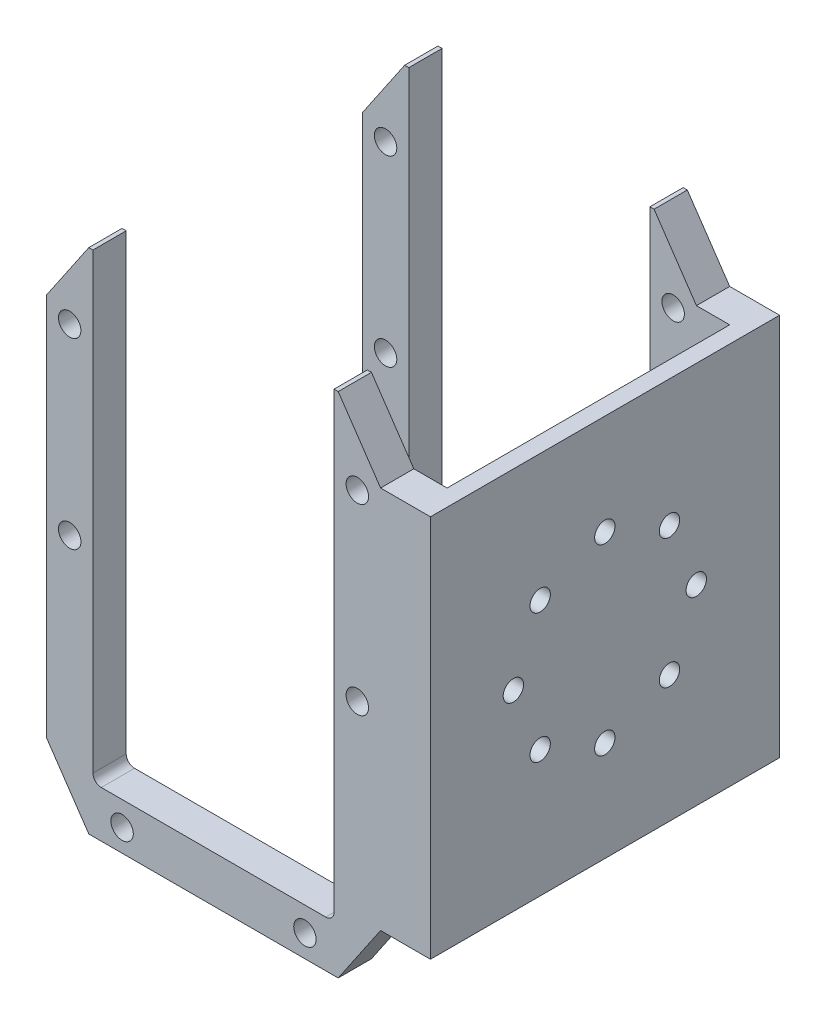
from build123d import *

# Parameters (mm, degrees)
EXTRUDE_2_DEPTH     = 42
SKETCH_2_R          = 1.35
CUT_EXTRUDE_1_DEPTH = 45
CUT_EXTRUDE_2_DEPTH = 45
SKETCH_4_W          = 4
SKETCH_4_H          = 46.1
EXTRUDE_3_DEPTH     = 4
SKETCH_5_W          = 2
SKETCH_5_H          = 46.1
EXTRUDE_4_DEPTH     = 42
SKETCH_6_R          = 1.225
CUT_EXTRUDE_3_DEPTH = 10


with BuildPart() as part:
    # 스케치1 → 보스-돌출2 (new body)
    with BuildSketch(Plane.XY):
        with BuildLine():
            Line((-14.5, -41.5), (-14.5, 11.5))
            Line((-14.5, 11.5), (-14.5, 13))
            Line((-14.5, 13), (-15, 13))
            Line((-15, 13), (-20.1, 5.5))
            Line((-20.1, 5.5), (-20.1, -40.6))
            Line((-20.1, -40.6), (-15, -48.1))
            Line((-15, -48.1), (15, -48.1))
            Line((15, -48.1), (20.1, -40.6))
            Line((20.1, -40.6), (20.1, 5.5))
            Line((20.1, 5.5), (15, 13))
            Line((15, 13), (14.5, 13))
            Line((14.5, 13), (14.5, 11.5))
            Line((14.5, 11.5), (14.5, -41.5))
            ThreePointArc((14.5, -41.5), (14.207106781, -42.207106781), (13.5, -42.5))
            Line((13.5, -42.5), (-13.5, -42.5))
            ThreePointArc((-13.5, -42.5), (-14.207106781, -42.207106781), (-14.5, -41.5))
        make_face()
    extrude(amount=EXTRUDE_2_DEPTH)

    # 스케치2 → 컷-돌출1 (cut)
    with BuildSketch(Plane(origin=(0, 0, 0), x_dir=(-1, 0, 0), z_dir=(0, 0, -1))):
        with Locations((-11, -45.405560676)):
            Circle(SKETCH_2_R)
        with Locations((11, -45.405560676)):
            Circle(SKETCH_2_R)
        with Locations((17.3, 3.87)):
            Circle(SKETCH_2_R)
        with Locations((17.3, -18.13)):
            Circle(SKETCH_2_R)
        with Locations((-17.3, 3.87)):
            Circle(SKETCH_2_R)
        with Locations((-17.3, -18.13)):
            Circle(SKETCH_2_R)
    extrude(amount=-CUT_EXTRUDE_1_DEPTH, mode=Mode.SUBTRACT)

    # 스케치3 → 컷-돌출2 (cut)
    with BuildSketch(Plane(origin=(20.1, 0, 0), x_dir=(0, 0, -1), z_dir=(1, 0, 0))):
        Polygon((-38, 5.5), (-38, -40.6), (-38, -48.1), (-4, -48.1), (-4, -40.6), (-4, 5.5), (-4, 13), (-38, 13), align=None)
    extrude(amount=-CUT_EXTRUDE_2_DEPTH, mode=Mode.SUBTRACT)


with BuildPart() as cut_extrude_2_piece_1:
    # of the separate pieces the step leaves, piece 1, a body of its own (cut_extrude_2_pieces)
    add(part.part.solids().sort_by_distance((-14.5, -41.5, 38))[0])



with BuildPart() as cut_extrude_2_piece_2:
    # of the separate pieces the step leaves, piece 2, a body of its own (cut_extrude_2_pieces)
    add(part.part.solids().sort_by_distance((-14.5, -41.5, 0))[0])


with BuildPart() as cut_extrude_2_piece_1_1:
    add(cut_extrude_2_piece_1.part)

    add(cut_extrude_2_piece_2.part)  # 보스-돌출3 merges 컷-돌출2 piece 2
    # 스케치4 → 보스-돌출3 (add)
    with BuildSketch(Plane(origin=(20.1, 0, 0), x_dir=(0, 0, -1), z_dir=(1, 0, 0))):
        with Locations((-40, -17.55)):
            Rectangle(SKETCH_4_W, SKETCH_4_H)
        with Locations((-2, -17.55)):
            Rectangle(SKETCH_4_W, SKETCH_4_H)
    extrude(amount=EXTRUDE_3_DEPTH)

    # 스케치5 → 보스-돌출4 (add)
    with BuildSketch(Plane.XY.offset(42)):
        with Locations((25.1, -17.55)):
            Rectangle(SKETCH_5_W, SKETCH_5_H)
    extrude(amount=-EXTRUDE_4_DEPTH)

    # 스케치6 → 컷-돌출3 (cut)
    with BuildSketch(Plane(origin=(26.1, 0, 0), x_dir=(0, 0, -1), z_dir=(1, 0, 0))):
        with Locations((-28.801064549, -9.782397482)):
            Circle(SKETCH_6_R)
        with Locations((-21.022889956, -6.560572075)):
            Circle(SKETCH_6_R)
        with Locations((-13.244715363, -9.782397482)):
            Circle(SKETCH_6_R)
        with Locations((-10.022889956, -17.560572075)):
            Circle(SKETCH_6_R)
        with Locations((-13.244715363, -25.338746668)):
            Circle(SKETCH_6_R)
        with Locations((-21.022889956, -28.560572075)):
            Circle(SKETCH_6_R)
        with Locations((-28.801064549, -25.338746668)):
            Circle(SKETCH_6_R)
        with Locations((-32.022889956, -17.560572075)):
            Circle(SKETCH_6_R)
    extrude(amount=-CUT_EXTRUDE_3_DEPTH, mode=Mode.SUBTRACT)


solid = cut_extrude_2_piece_1_1.part
